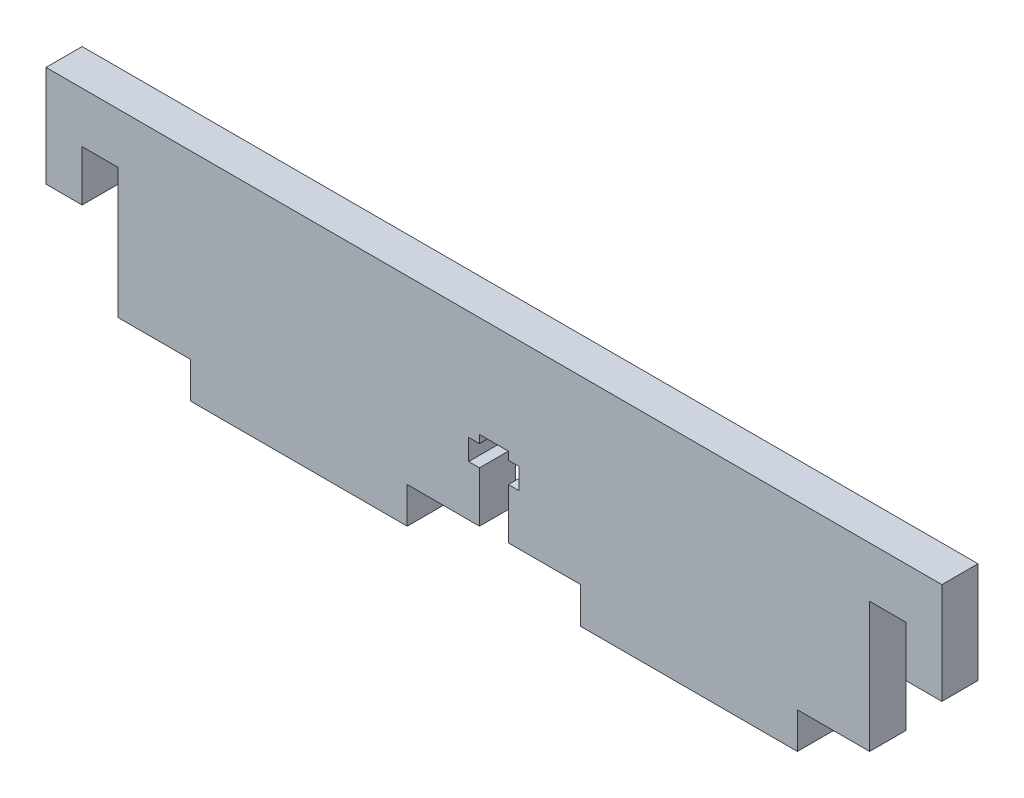
from build123d import *

# Parameters (mm, degrees)
SKETCH_1_W      = 5
SKETCH_1_H      = 7
SKETCH_1_H_2    = 14
SKETCH_1_W_2    = 30
SKETCH_1_H_3    = 5
EXTRUDE_2_DEPTH = 5


with BuildPart() as part:
    # 草图1 → 凸台-拉伸2 (new body)
    with BuildSketch(Plane.XY):
        with Locations((-106.5, 21.5)):
            Rectangle(SKETCH_1_W, SKETCH_1_H)
        with Locations((-111.5, 18)):
            Rectangle(SKETCH_1_W, SKETCH_1_H_2)
        Polygon((-64, 0), (-54, 0), (-54, 7), (-55.5, 7), (-55.5, 9.9), (-54, 9.9), (-54, 11), (-52, 11), (-52, 25), (-104, 25), (-104, 18), (-104, 0), (-94, 0), align=None)
        Polygon((-50, 7), (-50, 0), (-40, 0), (-10, 0), (0, 0), (0, 18), (0, 25), (-52, 25), (-52, 11), (-50, 11), (-50, 9.9), (-48.5, 9.9), (-48.5, 7), align=None)
        with Locations((7.5, 18)):
            Rectangle(SKETCH_1_W, SKETCH_1_H_2)
        with Locations((2.5, 21.5)):
            Rectangle(SKETCH_1_W, SKETCH_1_H)
        with Locations((-25, -2.5)):
            Rectangle(SKETCH_1_W_2, SKETCH_1_H_3)
        with Locations((-79, -2.5)):
            Rectangle(SKETCH_1_W_2, SKETCH_1_H_3)
    extrude(amount=EXTRUDE_2_DEPTH)


solid = part.part
